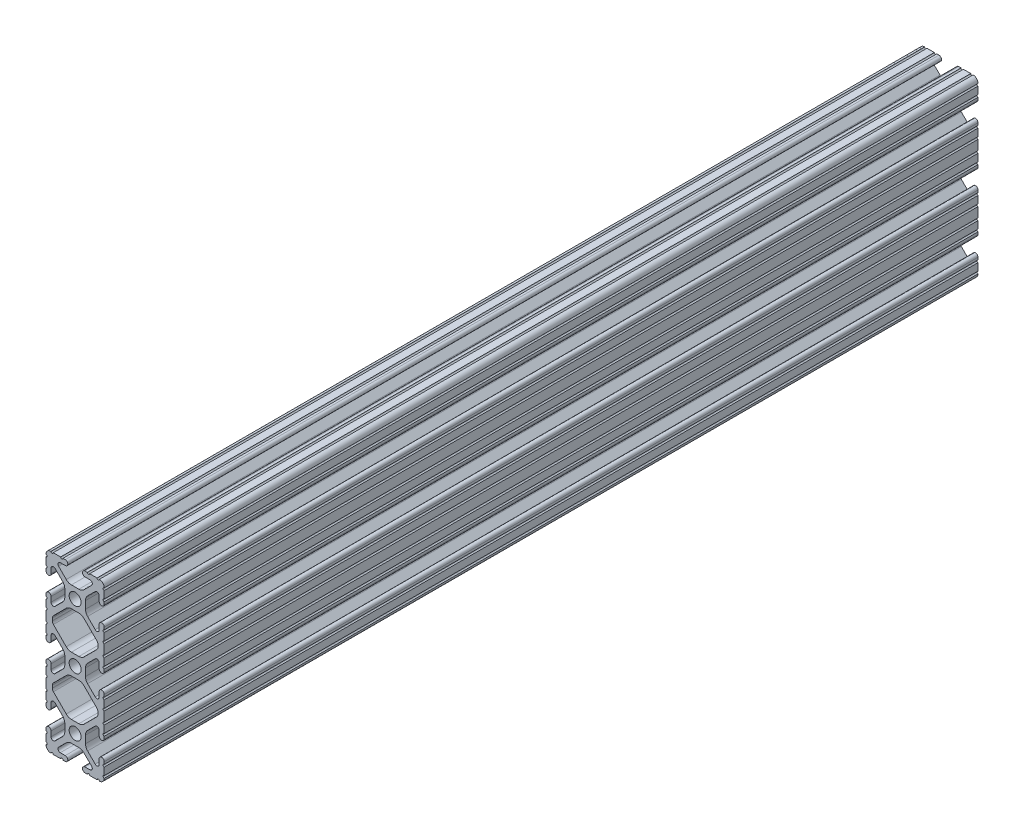
from build123d import *

# Parameters (mm, degrees)
SKETCH1_R           = 2.6035
BOSS_EXTRUDE1_DEPTH = 190.5


with BuildPart() as part:
    # Sketch1 → Boss-Extrude1 (new, symmetric)
    with BuildSketch(Plane.XY):
        with BuildLine():
            Line((-12.7, 34.9504), (-12.7, 31.7246))
            ThreePointArc((-12.7, 31.7246), (-12.192, 31.2166), (-12.7, 30.7086))
            Line((-12.7, 30.7086), (-12.7, 29.702307889))
            ThreePointArc((-12.7, 29.702307889), (-11.5951, 28.597407889), (-10.4902, 29.702307889))
            Line((-10.4902, 29.702307889), (-10.4902, 31.874794456))
            ThreePointArc((-10.4902, 31.874794456), (-9.863006367, 32.813456061), (-8.75577951, 32.593214945))
            Line((-8.75577951, 32.593214945), (-5.43843597, 29.275871405))
            ThreePointArc((-5.43843597, 29.275871405), (-4.750182484, 28.245827272), (-4.5085, 27.030807374))
            Line((-4.5085, 27.030807374), (-4.5085, 23.769192626))
            ThreePointArc((-4.5085, 23.769192626), (-4.750182484, 22.554172728), (-5.43843597, 21.524128595))
            Line((-5.43843597, 21.524128595), (-8.75577951, 18.206785055))
            ThreePointArc((-8.75577951, 18.206785055), (-9.863006367, 17.986543939), (-10.4902, 18.925205544))
            Line((-10.4902, 18.925205544), (-10.4902, 21.097692111))
            ThreePointArc((-10.4902, 21.097692111), (-11.5951, 22.202592111), (-12.7, 21.097692111))
            Line((-12.7, 21.097692111), (-12.7, 20.0914))
            ThreePointArc((-12.7, 20.0914), (-12.192, 19.5834), (-12.7, 19.0754))
            Line((-12.7, 19.0754), (-12.7, 15.8496))
            ThreePointArc((-12.7, 15.8496), (-12.192, 15.3416), (-12.7, 14.8336))
            Line((-12.7, 14.8336), (-12.7, 10.5664))
            ThreePointArc((-12.7, 10.5664), (-12.192, 10.0584), (-12.7, 9.5504))
            Line((-12.7, 9.5504), (-12.7, 6.3246))
            ThreePointArc((-12.7, 6.3246), (-12.192000017, 5.8166), (-12.7, 5.3086))
            Line((-12.7, 5.3086), (-12.7, 4.302307889))
            ThreePointArc((-12.7, 4.302307889), (-11.5951, 3.197407889), (-10.4902, 4.302307889))
            Line((-10.4902, 4.302307889), (-10.4902, 6.474794456))
            ThreePointArc((-10.4902, 6.474794456), (-9.863006367, 7.413456061), (-8.75577951, 7.193214945))
            Line((-8.75577951, 7.193214945), (-5.43843597, 3.875871405))
            ThreePointArc((-5.43843597, 3.875871405), (-4.750182484, 2.845827272), (-4.5085, 1.630807374))
            Line((-4.5085, 1.630807374), (-4.5085, -1.630807374))
            ThreePointArc((-4.5085, -1.630807374), (-4.750182484, -2.845827272), (-5.43843597, -3.875871405))
            Line((-5.43843597, -3.875871405), (-8.75577951, -7.193214945))
            ThreePointArc((-8.75577951, -7.193214945), (-9.863006367, -7.413456061), (-10.4902, -6.474794456))
            Line((-10.4902, -6.474794456), (-10.4902, -4.302307889))
            ThreePointArc((-10.4902, -4.302307889), (-11.5951, -3.197407889), (-12.7, -4.302307889))
            Line((-12.7, -4.302307889), (-12.7, -5.3086))
            ThreePointArc((-12.7, -5.3086), (-12.191999983, -5.8166), (-12.7, -6.3246))
            Line((-12.7, -6.3246), (-12.7, -9.5504))
            ThreePointArc((-12.7, -9.5504), (-12.192, -10.0584), (-12.7, -10.5664))
            Line((-12.7, -10.5664), (-12.7, -14.8336))
            ThreePointArc((-12.7, -14.8336), (-12.192, -15.3416), (-12.7, -15.8496))
            Line((-12.7, -15.8496), (-12.7, -19.0754))
            ThreePointArc((-12.7, -19.0754), (-12.192, -19.5834), (-12.7, -20.0914))
            Line((-12.7, -20.0914), (-12.7, -21.097692111))
            ThreePointArc((-12.7, -21.097692111), (-11.5951, -22.202592111), (-10.4902, -21.097692111))
            Line((-10.4902, -21.097692111), (-10.4902, -18.925205544))
            ThreePointArc((-10.4902, -18.925205544), (-9.863006367, -17.986543939), (-8.75577951, -18.206785055))
            Line((-8.75577951, -18.206785055), (-5.43843597, -21.524128595))
            ThreePointArc((-5.43843597, -21.524128595), (-4.750182484, -22.554172728), (-4.5085, -23.769192626))
            Line((-4.5085, -23.769192626), (-4.5085, -27.030807374))
            ThreePointArc((-4.5085, -27.030807374), (-4.750182484, -28.245827272), (-5.43843597, -29.275871405))
            Line((-5.43843597, -29.275871405), (-8.75577951, -32.593214945))
            ThreePointArc((-8.75577951, -32.593214945), (-9.863006367, -32.813456061), (-10.4902, -31.874794456))
            Line((-10.4902, -31.874794456), (-10.4902, -29.702307889))
            ThreePointArc((-10.4902, -29.702307889), (-11.5951, -28.597407889), (-12.7, -29.702307889))
            Line((-12.7, -29.702307889), (-12.7, -30.7086))
            ThreePointArc((-12.7, -30.7086), (-12.192, -31.2166), (-12.7, -31.7246))
            Line((-12.7, -31.7246), (-12.7, -34.9504))
            ThreePointArc((-12.7, -34.9504), (-12.192, -35.4584), (-12.7, -35.9664))
            ThreePointArc((-12.7, -35.9664), (-12.082677406, -37.482677406), (-10.5664, -38.1))
            ThreePointArc((-10.5664, -38.1), (-10.0584, -37.592), (-9.5504, -38.1))
            Line((-9.5504, -38.1), (-6.3246, -38.1))
            ThreePointArc((-6.3246, -38.1), (-5.816599996, -37.592000017), (-5.3086, -38.100000008))
            Line((-5.3086, -38.100000008), (-4.302307889, -38.100000008))
            ThreePointArc((-4.302307889, -38.100000008), (-3.197407889, -36.995100008), (-4.302307889, -35.890200008))
            Line((-4.302307889, -35.890200008), (-6.474794456, -35.890200008))
            ThreePointArc((-6.474794456, -35.890200008), (-7.413456061, -35.263006376), (-7.193214945, -34.155779519))
            Line((-7.193214945, -34.155779519), (-3.875871405, -30.838435978))
            ThreePointArc((-3.875871405, -30.838435978), (-2.845827272, -30.150182493), (-1.630807374, -29.908500008))
            Line((-1.630807374, -29.908500008), (1.630807374, -29.908500008))
            ThreePointArc((1.630807374, -29.908500008), (2.845827272, -30.150182493), (3.875871405, -30.838435978))
            Line((3.875871405, -30.838435978), (7.193214945, -34.155779519))
            ThreePointArc((7.193214945, -34.155779519), (7.413456061, -35.263006376), (6.474794456, -35.890200008))
            Line((6.474794456, -35.890200008), (4.302307889, -35.890200008))
            ThreePointArc((4.302307889, -35.890200008), (3.197407889, -36.995100008), (4.302307889, -38.100000008))
            Line((4.302307889, -38.100000008), (5.3086, -38.100000008))
            ThreePointArc((5.3086, -38.100000008), (5.8166, -37.591999992), (6.3246, -38.100000008))
            Line((6.3246, -38.100000008), (9.5504, -38.100000008))
            ThreePointArc((9.5504, -38.100000008), (10.0584, -37.592000008), (10.5664, -38.100000008))
            ThreePointArc((10.5664, -38.100000008), (12.082677406, -37.482677414), (12.7, -35.966400008))
            ThreePointArc((12.7, -35.966400008), (12.192, -35.458400008), (12.7, -34.950400008))
            Line((12.7, -34.950400008), (12.7, -31.724600008))
            ThreePointArc((12.7, -31.724600008), (12.192, -31.216600008), (12.7, -30.708600008))
            Line((12.7, -30.708600008), (12.7, -29.702307926))
            ThreePointArc((12.7, -29.702307926), (11.5951, -28.597407926), (10.4902, -29.702307926))
            Line((10.4902, -29.702307926), (10.4902, -31.874794464))
            ThreePointArc((10.4902, -31.874794464), (9.863006367, -32.813456069), (8.75577951, -32.593214954))
            Line((8.75577951, -32.593214954), (5.43843597, -29.275871413))
            ThreePointArc((5.43843597, -29.275871413), (4.750182484, -28.245827281), (4.5085, -27.030807383))
            Line((4.5085, -27.030807383), (4.5085, -23.769192634))
            ThreePointArc((4.5085, -23.769192634), (4.750182484, -22.554172736), (5.43843597, -21.524128604))
            Line((5.43843597, -21.524128604), (8.75577951, -18.206785063))
            ThreePointArc((8.75577951, -18.206785063), (9.863006367, -17.986543948), (10.4902, -18.925205553))
            Line((10.4902, -18.925205553), (10.4902, -21.097692067))
            ThreePointArc((10.4902, -21.097692067), (11.5951, -22.202592067), (12.7, -21.097692067))
            Line((12.7, -21.097692067), (12.7, -20.091400008))
            ThreePointArc((12.7, -20.091400008), (12.192, -19.583400008), (12.7, -19.075400008))
            Line((12.7, -19.075400008), (12.7, -15.849600008))
            ThreePointArc((12.7, -15.849600008), (12.192, -15.341600008), (12.7, -14.833600008))
            Line((12.7, -14.833600008), (12.7, -10.566400008))
            ThreePointArc((12.7, -10.566400008), (12.192, -10.058400008), (12.7, -9.550400008))
            Line((12.7, -9.550400008), (12.7, -6.324600008))
            ThreePointArc((12.7, -6.324600008), (12.192000017, -5.816600008), (12.7, -5.308600008))
            Line((12.7, -5.308600008), (12.7, -4.302307897))
            ThreePointArc((12.7, -4.302307897), (11.5951, -3.197407897), (10.4902, -4.302307897))
            Line((10.4902, -4.302307897), (10.4902, -6.474794464))
            ThreePointArc((10.4902, -6.474794464), (9.863006367, -7.413456069), (8.75577951, -7.193214954))
            Line((8.75577951, -7.193214954), (5.43843597, -3.875871413))
            ThreePointArc((5.43843597, -3.875871413), (4.750182484, -2.845827281), (4.5085, -1.630807383))
            Line((4.5085, -1.630807383), (4.5085, 1.630807366))
            ThreePointArc((4.5085, 1.630807366), (4.750182484, 2.845827264), (5.43843597, 3.875871396))
            Line((5.43843597, 3.875871396), (8.75577951, 7.193214937))
            ThreePointArc((8.75577951, 7.193214937), (9.863006367, 7.413456052), (10.4902, 6.474794447))
            Line((10.4902, 6.474794447), (10.4902, 4.302307881))
            ThreePointArc((10.4902, 4.302307881), (11.5951, 3.197407881), (12.7, 4.302307881))
            Line((12.7, 4.302307881), (12.7, 5.308599992))
            ThreePointArc((12.7, 5.308599992), (12.191999983, 5.816599992), (12.7, 6.324599992))
            Line((12.7, 6.324599992), (12.7, 9.550399992))
            ThreePointArc((12.7, 9.550399992), (12.192, 10.058399992), (12.7, 10.566399992))
            Line((12.7, 10.566399992), (12.7, 14.833599992))
            ThreePointArc((12.7, 14.833599992), (12.192, 15.341599992), (12.7, 15.849599992))
            Line((12.7, 15.849599992), (12.7, 19.075399992))
            ThreePointArc((12.7, 19.075399992), (12.192, 19.583399992), (12.7, 20.091399992))
            Line((12.7, 20.091399992), (12.7, 21.097692074))
            ThreePointArc((12.7, 21.097692074), (11.5951, 22.202592074), (10.4902, 21.097692074))
            Line((10.4902, 21.097692074), (10.4902, 18.925205536))
            ThreePointArc((10.4902, 18.925205536), (9.863006367, 17.986543931), (8.75577951, 18.206785046))
            Line((8.75577951, 18.206785046), (5.43843597, 21.524128587))
            ThreePointArc((5.43843597, 21.524128587), (4.750182484, 22.554172719), (4.5085, 23.769192617))
            Line((4.5085, 23.769192617), (4.5085, 27.030807366))
            ThreePointArc((4.5085, 27.030807366), (4.750182484, 28.245827264), (5.43843597, 29.275871396))
            Line((5.43843597, 29.275871396), (8.75577951, 32.593214937))
            ThreePointArc((8.75577951, 32.593214937), (9.863006367, 32.813456052), (10.4902, 31.874794447))
            Line((10.4902, 31.874794447), (10.4902, 29.702307881))
            ThreePointArc((10.4902, 29.702307881), (11.5951, 28.597407881), (12.7, 29.702307881))
            Line((12.7, 29.702307881), (12.7, 30.708599992))
            ThreePointArc((12.7, 30.708599992), (12.192, 31.216599992), (12.7, 31.724599992))
            Line((12.7, 31.724599992), (12.7, 34.9504))
            ThreePointArc((12.7, 34.9504), (12.192, 35.4584), (12.7, 35.9664))
            ThreePointArc((12.7, 35.9664), (12.082677406, 37.482677406), (10.5664, 38.1))
            ThreePointArc((10.5664, 38.1), (10.0584, 37.592), (9.5504, 38.1))
            Line((9.5504, 38.1), (6.3246, 38.1))
            ThreePointArc((6.3246, 38.1), (5.8166, 37.591999983), (5.3086, 38.1))
            Line((5.3086, 38.1), (4.302307889, 38.1))
            ThreePointArc((4.302307889, 38.1), (3.197407889, 36.9951), (4.302307889, 35.8902))
            Line((4.302307889, 35.8902), (6.474794456, 35.8902))
            ThreePointArc((6.474794456, 35.8902), (7.413456061, 35.263006367), (7.193214945, 34.15577951))
            Line((7.193214945, 34.15577951), (3.875871405, 30.83843597))
            ThreePointArc((3.875871405, 30.83843597), (2.845827272, 30.150182484), (1.630807374, 29.9085))
            Line((1.630807374, 29.9085), (-1.630807374, 29.9085))
            ThreePointArc((-1.630807374, 29.9085), (-2.845827272, 30.150182484), (-3.875871405, 30.83843597))
            Line((-3.875871405, 30.83843597), (-7.193214945, 34.15577951))
            ThreePointArc((-7.193214945, 34.15577951), (-7.413456061, 35.263006367), (-6.474794456, 35.8902))
            Line((-6.474794456, 35.8902), (-4.302307889, 35.8902))
            ThreePointArc((-4.302307889, 35.8902), (-3.197407889, 36.9951), (-4.302307889, 38.1))
            Line((-4.302307889, 38.1), (-5.3086, 38.1))
            ThreePointArc((-5.3086, 38.1), (-5.8166, 37.592000017), (-6.3246, 38.1))
            Line((-6.3246, 38.1), (-9.5504, 38.1))
            ThreePointArc((-9.5504, 38.1), (-10.0584, 37.592), (-10.5664, 38.1))
            ThreePointArc((-10.5664, 38.1), (-12.082677406, 37.482677406), (-12.7, 35.9664))
            ThreePointArc((-12.7, 35.9664), (-12.192, 35.4584), (-12.7, 34.9504))
        make_face()
        with Locations((0, -25.4)):
            Circle(SKETCH1_R, mode=Mode.SUBTRACT)
        Circle(SKETCH1_R, mode=Mode.SUBTRACT)
        with Locations((0, 25.4)):
            Circle(SKETCH1_R, mode=Mode.SUBTRACT)
        with BuildLine():
            Line((-9.9314, -12.146268083), (-9.9314, -13.253731917))
            ThreePointArc((-9.9314, -13.253731917), (-9.811525488, -13.856381786), (-9.470151759, -14.367283676))
            Line((-9.470151759, -14.367283676), (-3.875871405, -19.96156403))
            ThreePointArc((-3.875871405, -19.96156403), (-2.845827272, -20.649817516), (-1.630807374, -20.8915))
            Line((-1.630807374, -20.8915), (1.630807374, -20.8915))
            ThreePointArc((1.630807374, -20.8915), (2.845827272, -20.649817516), (3.875871405, -19.96156403))
            Line((3.875871405, -19.96156403), (9.470151759, -14.367283676))
            ThreePointArc((9.470151759, -14.367283676), (9.811525488, -13.856381786), (9.9314, -13.253731917))
            Line((9.9314, -13.253731917), (9.9314, -12.146268083))
            ThreePointArc((9.9314, -12.146268083), (9.811525488, -11.543618214), (9.470151759, -11.032716324))
            Line((9.470151759, -11.032716324), (3.875871405, -5.43843597))
            ThreePointArc((3.875871405, -5.43843597), (2.845827272, -4.750182484), (1.630807374, -4.5085))
            Line((1.630807374, -4.5085), (-1.630807374, -4.5085))
            ThreePointArc((-1.630807374, -4.5085), (-2.845827272, -4.750182484), (-3.875871405, -5.43843597))
            Line((-3.875871405, -5.43843597), (-9.470151759, -11.032716324))
            ThreePointArc((-9.470151759, -11.032716324), (-9.811525488, -11.543618214), (-9.9314, -12.146268083))
        make_face(mode=Mode.SUBTRACT)
        with BuildLine():
            Line((-9.9314, 13.253731917), (-9.9314, 12.146268083))
            ThreePointArc((-9.9314, 12.146268083), (-9.811525488, 11.543618214), (-9.470151759, 11.032716324))
            Line((-9.470151759, 11.032716324), (-3.875871405, 5.43843597))
            ThreePointArc((-3.875871405, 5.43843597), (-2.845827272, 4.750182484), (-1.630807374, 4.5085))
            Line((-1.630807374, 4.5085), (1.630807374, 4.5085))
            ThreePointArc((1.630807374, 4.5085), (2.845827272, 4.750182484), (3.875871405, 5.43843597))
            Line((3.875871405, 5.43843597), (9.470151759, 11.032716324))
            ThreePointArc((9.470151759, 11.032716324), (9.811525488, 11.543618214), (9.9314, 12.146268083))
            Line((9.9314, 12.146268083), (9.9314, 13.253731917))
            ThreePointArc((9.9314, 13.253731917), (9.811525488, 13.856381786), (9.470151759, 14.367283676))
            Line((9.470151759, 14.367283676), (3.875871405, 19.96156403))
            ThreePointArc((3.875871405, 19.96156403), (2.845827272, 20.649817516), (1.630807374, 20.8915))
            Line((1.630807374, 20.8915), (-1.630807374, 20.8915))
            ThreePointArc((-1.630807374, 20.8915), (-2.845827272, 20.649817516), (-3.875871405, 19.96156403))
            Line((-3.875871405, 19.96156403), (-9.470151759, 14.367283676))
            ThreePointArc((-9.470151759, 14.367283676), (-9.811525488, 13.856381786), (-9.9314, 13.253731917))
        make_face(mode=Mode.SUBTRACT)
    extrude(amount=BOSS_EXTRUDE1_DEPTH, both=True)


solid = part.part
